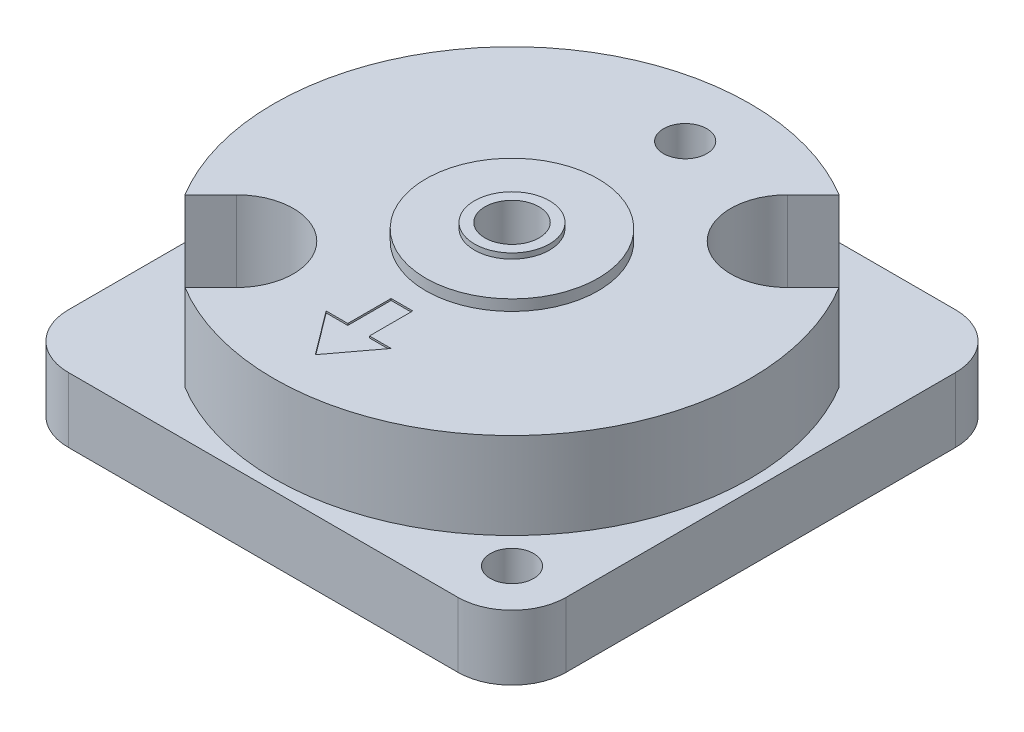
from build123d import *

# Parameters (mm, degrees)
SKETCH4_W                       = 73.025
SKETCH4_H                       = 73.025
BOSS_EXTRUDE1_DEPTH             = 9.525
SKETCH7_R                       = 34.925
BOSS_EXTRUDE3_DEPTH             = 12.7
FILLET1_R                       = 7.9502
SKETCH8_R                       = 12.6365
BOSS_EXTRUDE4_DEPTH             = 1.6002
SKETCH9_R                       = 5.4991
BOSS_EXTRUDE5_DEPTH             = 0.7874
CUT_EXTRUDE1_START              = -12.7
CUT_EXTRUDE1_DEPTH              = 12.7
CIRPATTERN1_COUNT               = 2
SKETCH11_R                      = 5.08
CUT_EXTRUDE2_DEPTH              = 54.795548015
F_1_4_0_25_DIAMETER_HOLE1_D     = 6.35
F_1_4_0_25_DIAMETER_HOLE2_D     = 6.35
F_1_4_0_25_DIAMETER_HOLE2_DEPTH = 14.3002
F_1_4_0_25_DIAMETER_HOLE2_TIP   = 1.907732465
F_3_8_16_TAPPED_HOLE1_D         = 7.9375
F_3_8_16_TAPPED_HOLE1_DEPTH     = 15.875
F_3_8_16_TAPPED_HOLE1_TIP       = 2.384665582
CUT_EXTRUDE3_DEPTH              = 0.254


with BuildPart() as part:
    # Sketch4 → Boss-Extrude1 (new body)
    with BuildSketch(Plane(origin=(0, 0, 0), x_dir=(1, 0, 0), z_dir=(0, 1, 0))):
        Rectangle(SKETCH4_W, SKETCH4_H)
    extrude(amount=BOSS_EXTRUDE1_DEPTH)

    # Sketch7 → Boss-Extrude3 (add)
    with BuildSketch(Plane(origin=(0, 9.525, 0), x_dir=(1, 0, 0), z_dir=(0, 1, 0))):
        with Locations(Location((0, 0, 0), (0, 0, 270))):
            Circle(SKETCH7_R)
    extrude(amount=BOSS_EXTRUDE3_DEPTH)

    # Fillet1
    fillet1_edges = [part.edges().sort_by_distance(p)[0] for p in [
        (36.5125, 4.7625, 36.5125),
        (-36.5125, 4.7625, 36.5125),
        (-36.5125, 4.7625, -36.5125),
        (36.5125, 4.7625, -36.5125),
    ]]
    fillet(fillet1_edges, radius=FILLET1_R)

    # Sketch8 → Boss-Extrude4 (add)
    with BuildSketch(Plane(origin=(0, 22.225, 0), x_dir=(1, 0, 0), z_dir=(0, 1, 0))):
        with Locations(Location((0, 0, 0), (0, 0, 270))):
            Circle(SKETCH8_R)
    extrude(amount=BOSS_EXTRUDE4_DEPTH)

    # Sketch9 → Boss-Extrude5 (add)
    with BuildSketch(Plane(origin=(0, 23.8252, 0), x_dir=(1, 0, 0), z_dir=(0, 1, 0))):
        with Locations(Location((0, 0, 0), (0, 0, 270))):
            Circle(SKETCH9_R)
    extrude(amount=BOSS_EXTRUDE5_DEPTH)

    # Sketch10 → Cut-Extrude1 (cut)
    with BuildSketch(Plane(origin=(0, 22.225, 0), x_dir=(1, 0, 0), z_dir=(0, 1, 0)).offset(CUT_EXTRUDE1_START)):
        with BuildLine():
            Line((26.096624288, 14.314528257), (29.873820286, 18.091724255))
            ThreePointArc((29.873820286, 18.091724255), (24.695704333, 24.695704333), (18.091724255, 29.873820286))
            Line((18.091724255, 29.873820286), (14.314528257, 26.096624288))
            ThreePointArc((14.314528257, 26.096624288), (14.314528257, 14.314528257), (26.096624288, 14.314528257))
        make_face()
    cut_extrude1 = extrude(amount=CUT_EXTRUDE1_DEPTH, mode=Mode.SUBTRACT)

    # CirPattern1: Cut-Extrude1 ×2 about axis
    cirpattern1_axis = Axis((0, 0, 0), (0, 1, 0))
    for i in range(1, CIRPATTERN1_COUNT):
        add(cut_extrude1.rotate(cirpattern1_axis, i * 360 / CIRPATTERN1_COUNT), mode=Mode.SUBTRACT)

    # Sketch11 → Cut-Extrude2 (cut, through all)
    with BuildSketch(Plane(origin=(0, 9.525, 0), x_dir=(1, 0, 0), z_dir=(0, 1, 0))):
        with Locations(Location((20.205576272, 20.205576272, 0), (0, 0, 270))):
            Circle(SKETCH11_R)
        with Locations(Location((-20.205576272, -20.205576272, 0), (0, 0, 270))):
            Circle(SKETCH11_R)
    extrude(amount=-CUT_EXTRUDE2_DEPTH, mode=Mode.SUBTRACT)

    # 1/4 (0.25) Diameter Hole1 (through all)
    with Locations(Plane(origin=(0, 9.525, 0), x_dir=(1, 0, 0), z_dir=(0, 1, 0))):
        with Locations((-28.5623, 28.5623), (28.5623, -28.5623)):
            Hole(F_1_4_0_25_DIAMETER_HOLE1_D / 2)

    # 1/4 (0.25) Diameter Hole2
    with Locations(Plane(origin=(0, 22.225, 0), x_dir=(1, 0, 0), z_dir=(0, 1, 0))):
        with Locations((0, 25.4)):
            Hole(F_1_4_0_25_DIAMETER_HOLE2_D / 2, depth=F_1_4_0_25_DIAMETER_HOLE2_DEPTH)
            with Locations((0, 0, -(F_1_4_0_25_DIAMETER_HOLE2_DEPTH + F_1_4_0_25_DIAMETER_HOLE2_TIP / 2))):  # 118° drill point
                Cone(0, F_1_4_0_25_DIAMETER_HOLE2_D / 2, F_1_4_0_25_DIAMETER_HOLE2_TIP, mode=Mode.SUBTRACT)

    # 3/8-16 Tapped Hole1
    with Locations(Plane(origin=(0, 24.6126, 0), x_dir=(1, 0, 0), z_dir=(0, 1, 0))):
        with Locations((0, 0)):
            Hole(F_3_8_16_TAPPED_HOLE1_D / 2, depth=F_3_8_16_TAPPED_HOLE1_DEPTH)
            with Locations((0, 0, -(F_3_8_16_TAPPED_HOLE1_DEPTH + F_3_8_16_TAPPED_HOLE1_TIP / 2))):  # 118° drill point
                Cone(0, F_3_8_16_TAPPED_HOLE1_D / 2, F_3_8_16_TAPPED_HOLE1_TIP, mode=Mode.SUBTRACT)

    # Sketch18 → Cut-Extrude3 (cut)
    with BuildSketch(Plane(origin=(0, 22.225, 0), x_dir=(1, 0, 0), z_dir=(0, 1, 0))):
        Polygon((0, -28.845315502), (4.7625, -22.495315502), (1.5875, -22.495315502), (1.5875, -16.145315502), (-1.5875, -16.145315502), (-1.5875, -22.495315502), (-4.7625, -22.495315502), align=None)
    extrude(amount=-CUT_EXTRUDE3_DEPTH, mode=Mode.SUBTRACT)


solid = part.part
